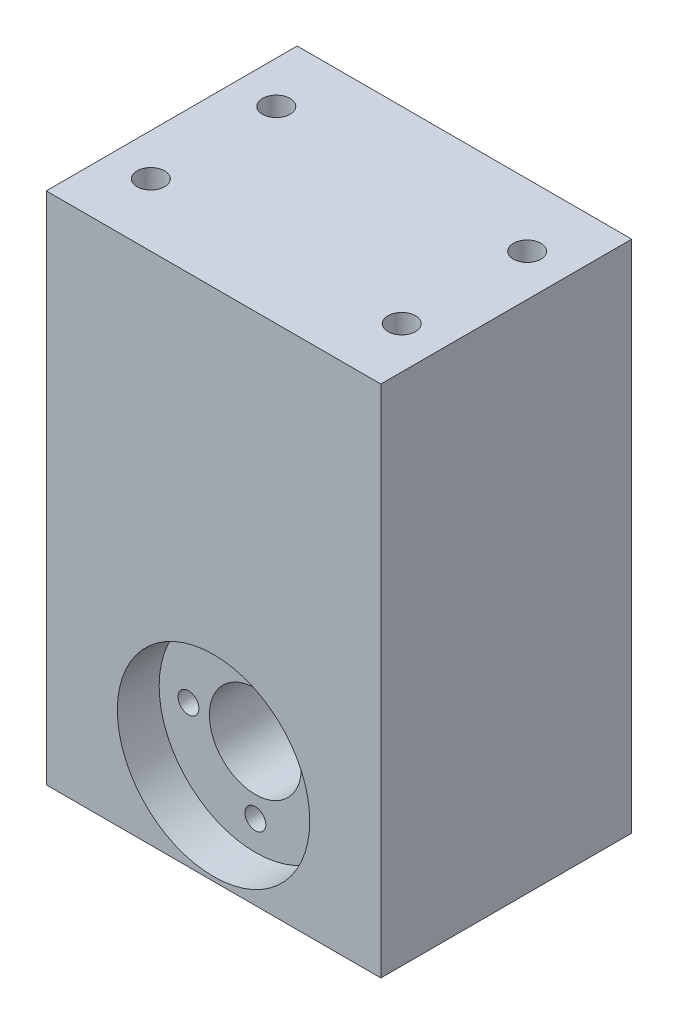
from build123d import *

# Parameters (mm, degrees)
SKETCH1_W             = 40
SKETCH1_H             = 62.5
BOSS_EXTRUDE1_DEPTH   = 15
SKETCH2_R             = 11.5
CUT_EXTRUDE1_DEPTH    = 5
SKETCH3_R             = 5.5
CUT_EXTRUDE2_DEPTH    = 71.222859526
M4_TAPPED_HOLE1_D     = 3.3
M4_TAPPED_HOLE1_DEPTH = 11.5
M4_TAPPED_HOLE1_TIP   = 0.991420021
M3_TAPPED_HOLE2_D     = 2.5
SKETCH9_W             = 40
SKETCH9_H             = 1
CUT_EXTRUDE4_DEPTH    = 73.154348448


with BuildPart() as part:
    # Sketch1 → Boss-Extrude1 (new, symmetric)
    with BuildSketch(Plane.XY):
        with Locations((0, 31.25)):
            Rectangle(SKETCH1_W, SKETCH1_H)
    extrude(amount=BOSS_EXTRUDE1_DEPTH, both=True)

    # Sketch2 → Cut-Extrude1 (cut)
    with BuildSketch(Plane.XY.offset(15)):
        with Locations((0, 13)):
            Circle(SKETCH2_R)
    extrude(amount=-CUT_EXTRUDE1_DEPTH, mode=Mode.SUBTRACT)

    # Sketch3 → Cut-Extrude2 (cut, through all)
    with BuildSketch(Plane.XY.offset(10)):
        with Locations((0, 13)):
            Circle(SKETCH3_R)
    extrude(amount=-CUT_EXTRUDE2_DEPTH, mode=Mode.SUBTRACT)

    # M4 Tapped Hole1
    with Locations(Plane(origin=(0, 62.5, 0), x_dir=(1, 0, 0), z_dir=(0, 1, 0))):
        with Locations((-15, 7.5), (15, 7.5), (15, -7.5), (-15, -7.5)):
            Hole(M4_TAPPED_HOLE1_D / 2, depth=M4_TAPPED_HOLE1_DEPTH)
            with Locations((0, 0, -(M4_TAPPED_HOLE1_DEPTH + M4_TAPPED_HOLE1_TIP / 2))):  # 118° drill point
                Cone(0, M4_TAPPED_HOLE1_D / 2, M4_TAPPED_HOLE1_TIP, mode=Mode.SUBTRACT)

    # M3 Tapped Hole2 (through all)
    with Locations(Plane.XY.offset(10)):
        with Locations((0, 13), (0, 21), (0, 5), (-8, 13), (8, 13)):
            Hole(M3_TAPPED_HOLE2_D / 2)

    # Sketch9 → Cut-Extrude4 (cut, through all)
    with BuildSketch(Plane.XY.offset(15)):
        with Locations((0, 0.5)):
            Rectangle(SKETCH9_W, SKETCH9_H)
    extrude(amount=-CUT_EXTRUDE4_DEPTH, mode=Mode.SUBTRACT)


solid = part.part
